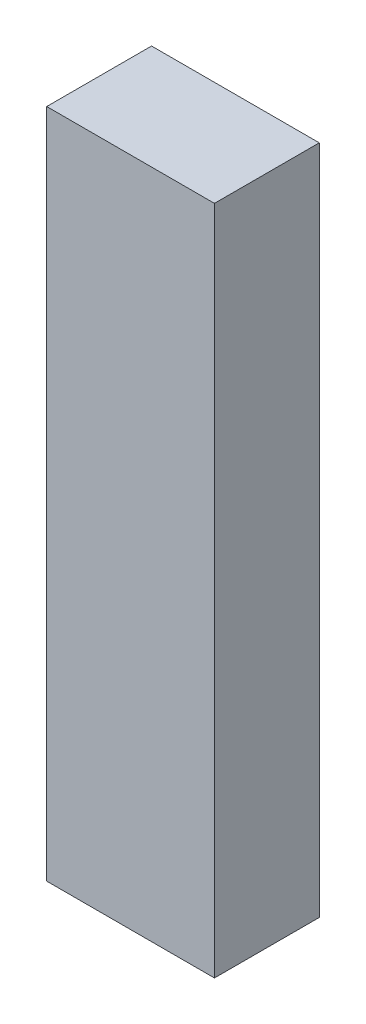
from build123d import *

# Parameters (mm, degrees)
SKETCH_1_W      = 32
SKETCH_1_H      = 128
EXTRUDE_1_DEPTH = 20


with BuildPart() as part:
    # 草图1 → 凸台-拉伸1 (new body)
    with BuildSketch(Plane.XY):
        Rectangle(SKETCH_1_W, SKETCH_1_H)
    extrude(amount=-EXTRUDE_1_DEPTH)


solid = part.part
